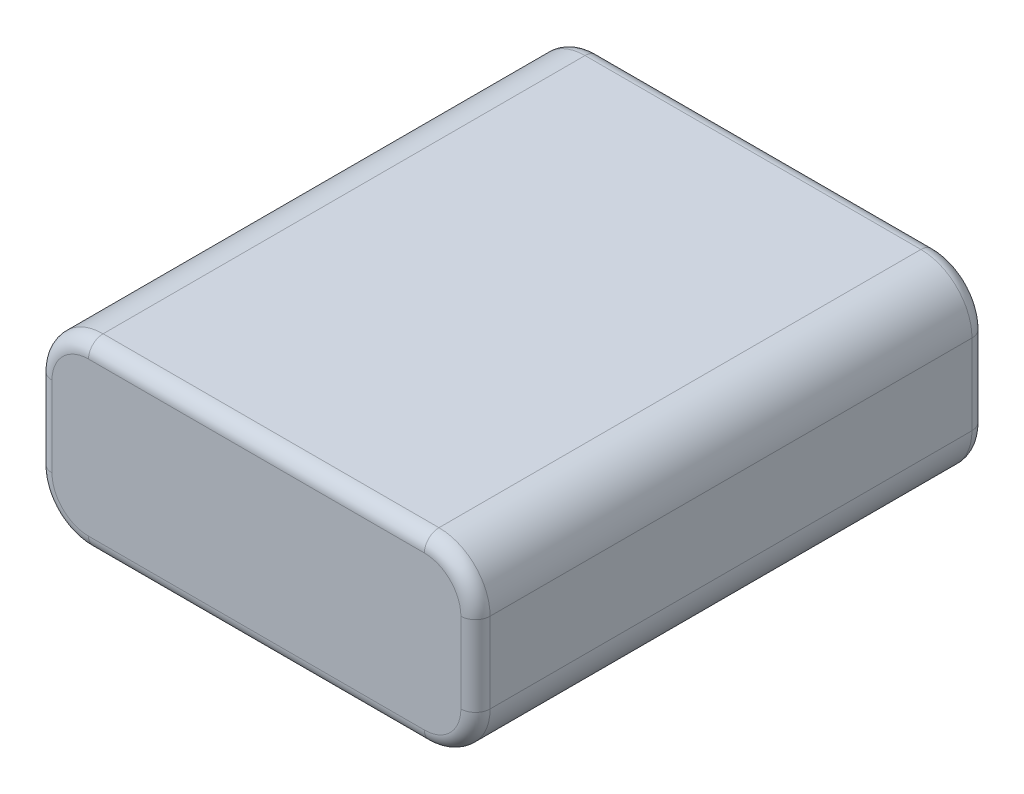
from build123d import *

# Parameters (mm, degrees)
BOSS_EXTRUDE1_DEPTH = 70
FILLET1_R           = 2


with BuildPart() as part:
    # Sketch1 → Boss-Extrude1 (new body)
    with BuildSketch(Plane.XY):
        with BuildLine():
            Line((7, 0), (53, 0))
            ThreePointArc((53, 0), (57.949747468, 2.050252532), (60, 7))
            Line((60, 7), (60, 18))
            ThreePointArc((60, 18), (57.949747468, 22.949747468), (53, 25))
            Line((53, 25), (7, 25))
            ThreePointArc((7, 25), (2.050252532, 22.949747468), (0, 18))
            Line((0, 18), (0, 7))
            ThreePointArc((0, 7), (2.050252532, 2.050252532), (7, 0))
        make_face()
    extrude(amount=BOSS_EXTRUDE1_DEPTH)

    # Fillet1
    fillet1_edges = [part.edges().sort_by_distance(p)[0] for p in [
        (0, 12.5, 0),
        (2.050252532, 22.949747468, 0),
        (30, 25, 0),
        (57.949747468, 22.949747468, 0),
        (2.050252532, 22.949747468, 70),
        (0, 12.5, 70),
        (2.050252532, 2.050252532, 70),
        (30, 0, 70),
        (57.949747468, 2.050252532, 70),
        (60, 12.5, 70),
        (57.949747468, 22.949747468, 70),
        (60, 12.5, 0),
        (30, 25, 70),
        (57.949747468, 2.050252532, 0),
        (30, 0, 0),
        (2.050252532, 2.050252532, 0),
    ]]
    fillet(fillet1_edges, radius=FILLET1_R)


solid = part.part
